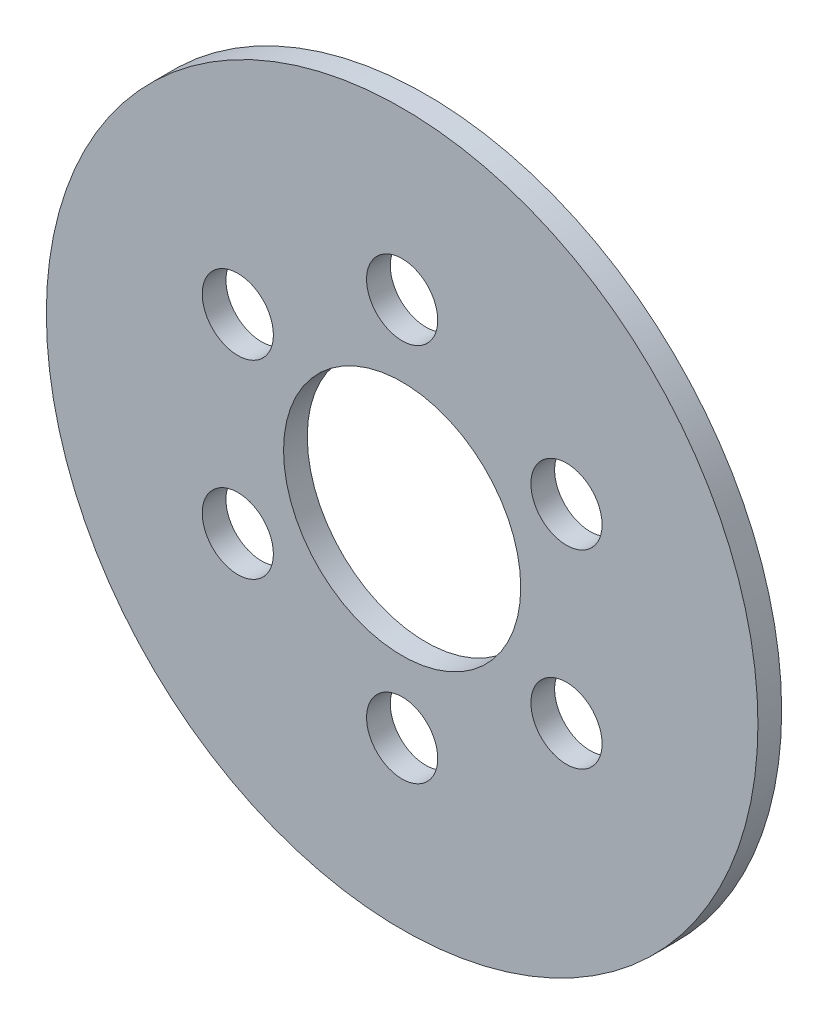
from build123d import *

# Parameters (mm, degrees)
SKETCH_1_R      = 15
SKETCH_1_R_2    = 1.5
SKETCH_1_R_3    = 5
EXTRUDE_1_DEPTH = 1


with BuildPart() as part:
    # 草图1 → 凸台-拉伸1 (new body)
    with BuildSketch(Plane.XY):
        Circle(SKETCH_1_R)
        with Locations((0, 8)):
            Circle(SKETCH_1_R_2, mode=Mode.SUBTRACT)
        with Locations((6.92820323, 4)):
            Circle(SKETCH_1_R_2, mode=Mode.SUBTRACT)
        with Locations((6.92820323, -4)):
            Circle(SKETCH_1_R_2, mode=Mode.SUBTRACT)
        with Locations((0, -8)):
            Circle(SKETCH_1_R_2, mode=Mode.SUBTRACT)
        with Locations((-6.92820323, -4)):
            Circle(SKETCH_1_R_2, mode=Mode.SUBTRACT)
        with Locations((-6.92820323, 4)):
            Circle(SKETCH_1_R_2, mode=Mode.SUBTRACT)
        Circle(SKETCH_1_R_3, mode=Mode.SUBTRACT)
    extrude(amount=EXTRUDE_1_DEPTH)


solid = part.part
